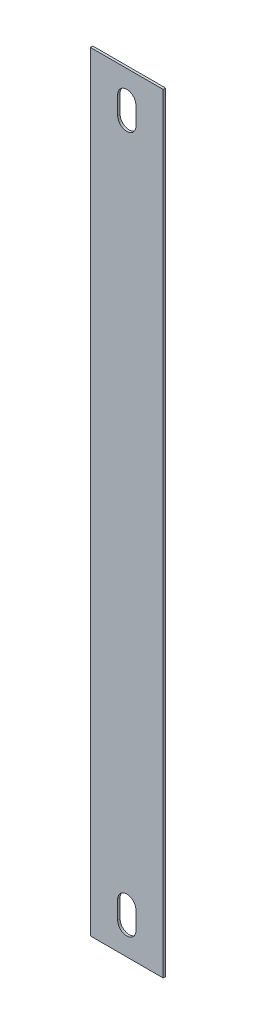
from build123d import *

# Parameters (mm, degrees)
SKETCH1_W           = 60
SKETCH1_H           = 634.64
BOSS_EXTRUDE1_DEPTH = 2
CUT_EXTRUDE1_REACH  = 320.741


with BuildPart() as part:
    # Sketch1 → Boss-Extrude1 (new body)
    with BuildSketch(Plane.XY):
        Rectangle(SKETCH1_W, SKETCH1_H)
    extrude(amount=BOSS_EXTRUDE1_DEPTH)

    # Sketch2 → Cut-Extrude1 (cut, up to next)
    with BuildSketch(Plane.XY.offset(2), mode=Mode.PRIVATE) as cut_extrude1_sk1:
        with BuildLine():
            Line((7.5, 294.82), (7.5, 279.82))
            ThreePointArc((7.5, 279.82), (0, 272.32), (-7.5, 279.82))
            Line((-7.5, 279.82), (-7.5, 294.82))
            ThreePointArc((-7.5, 294.82), (0, 302.32), (7.5, 294.82))
        make_face()
    cut_extrude1_tool1 = extrude(cut_extrude1_sk1.sketch, amount=-CUT_EXTRUDE1_REACH, mode=Mode.PRIVATE) & part.part
    # Sketch2 → Cut-Extrude1 (cut, up to next)
    with BuildSketch(Plane.XY.offset(2), mode=Mode.PRIVATE) as cut_extrude1_sk2:
        with BuildLine():
            Line((7.5, -294.82), (7.5, -279.82))
            ThreePointArc((7.5, -279.82), (0, -272.32), (-7.5, -279.82))
            Line((-7.5, -279.82), (-7.5, -294.82))
            ThreePointArc((-7.5, -294.82), (0, -302.32), (7.5, -294.82))
        make_face()
    cut_extrude1_tool2 = extrude(cut_extrude1_sk2.sketch, amount=-CUT_EXTRUDE1_REACH, mode=Mode.PRIVATE) & part.part
    add(cut_extrude1_tool1.solids().sort_by_distance((0, 287.32, 2))[0], mode=Mode.SUBTRACT)
    add(cut_extrude1_tool2.solids().sort_by_distance((0, -287.32, 2))[0], mode=Mode.SUBTRACT)


solid = part.part
